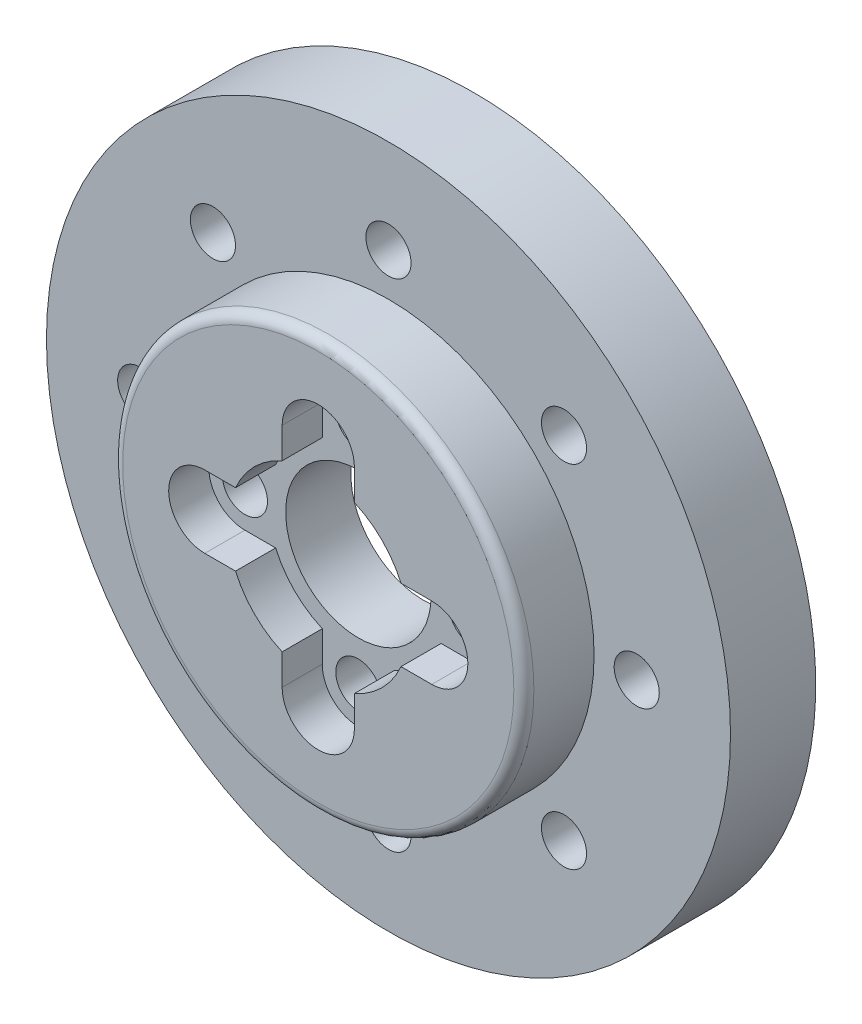
from build123d import *
from build123d.topology import SkipClean

# Parameters (mm, degrees)
SKETCH1_R               = 34.1
BOSS_EXTRUDE1_DEPTH     = 1.75
SKETCH4_R               = 28.5
BOSS_EXTRUDE2_DEPTH     = 2
SKETCH5_R               = 34.1
SKETCH5_R_2             = 16.25
BOSS_EXTRUDE3_DEPTH     = 5
CUT_EXTRUDE2_DEPTH      = 49.968050809
CUT_EXTRUDE2_DEPTH_BACK = 49.968050809
SKETCH3_R               = 2.25
CUT_EXTRUDE1_DEPTH      = 49.968050809
CUT_EXTRUDE1_DEPTH_BACK = 49.968050809
SKETCH2_R               = 7.25
SKETCH6_R               = 2.25
CUT_EXTRUDE3_DEPTH      = 50.354533733
CIRPATTERN1_COUNT       = 8
SKETCH7_R               = 20.5
SKETCH7_R_2             = 2.25
SKETCH7_R_3             = 7.25
BOSS_EXTRUDE4_DEPTH     = 5
BOSS_EXTRUDE5_START     = 2
SKETCH8_R               = 34.1
SKETCH8_R_2             = 28.5
BOSS_EXTRUDE5_DEPTH     = 2
SKETCH10_R              = 34.1
SKETCH10_R_2            = 20.5
CUT_EXTRUDE4_DEPTH      = 2
CUT_EXTRUDE5_DEPTH      = 4
SKETCH12_R              = 4.6
CUT_EXTRUDE6_DEPTH      = 3
FILLET2_R               = 1
FILLET3_R               = 1


with BuildPart() as part:
    # Sketch1 → Boss-Extrude1 (new, symmetric)
    with BuildSketch(Plane.XY):
        Circle(SKETCH1_R)
    extrude(amount=BOSS_EXTRUDE1_DEPTH, both=True)

    # Sketch4 → Boss-Extrude2 (add)
    with BuildSketch(Plane.XY.offset(1.75)):
        Circle(SKETCH4_R)
    extrude(amount=BOSS_EXTRUDE2_DEPTH)

    # Sketch5 → Boss-Extrude3 (add)
    with BuildSketch(Plane(origin=(0, 0, -1.75), x_dir=(-1, 0, 0), z_dir=(0, 0, -1))):
        Circle(SKETCH5_R)
        Circle(SKETCH5_R_2, mode=Mode.SUBTRACT)
    extrude(amount=BOSS_EXTRUDE3_DEPTH)

    # Sketch3 → Cut-Extrude2 (cut, two sides: drawn at the far end of the back side and taken through both)
    with BuildSketch(Plane.XY.offset(1.75).offset(-CUT_EXTRUDE2_DEPTH_BACK)):
        with Locations((0, 11.3137085)):
            Circle(SKETCH3_R)
        with Locations((11.3137085, 0)):
            Circle(SKETCH3_R)
        with Locations((0, -11.3137085)):
            Circle(SKETCH3_R)
        with Locations((-11.3137085, 0)):
            Circle(SKETCH3_R)
    extrude(amount=CUT_EXTRUDE2_DEPTH + CUT_EXTRUDE2_DEPTH_BACK, mode=Mode.SUBTRACT)

    # Sketch2 → Cut-Extrude1 (cut, two sides: drawn at the far end of the back side and taken through both)
    with BuildSketch(Plane.XY.offset(1.75).offset(-CUT_EXTRUDE1_DEPTH_BACK)):
        Circle(SKETCH2_R)
    extrude(amount=CUT_EXTRUDE1_DEPTH + CUT_EXTRUDE1_DEPTH_BACK, mode=Mode.SUBTRACT)

    # Sketch6 → Cut-Extrude3 (cut, symmetric)
    with BuildSketch(Plane.XY.offset(3.75)):
        with Locations((0, 24.75)):
            Circle(SKETCH6_R)
    cut_extrude3 = extrude(amount=CUT_EXTRUDE3_DEPTH, both=True, mode=Mode.SUBTRACT)

    # CirPattern1: Cut-Extrude3 ×8 about axis
    cirpattern1_axis = Axis((0, 0, 0), (0, 0, 1))
    for i in range(1, CIRPATTERN1_COUNT):
        add(cut_extrude3.rotate(cirpattern1_axis, i * 360 / CIRPATTERN1_COUNT), mode=Mode.SUBTRACT)

    # Sketch7 → Boss-Extrude4 (add)
    with BuildSketch(Plane.XY.offset(3.75)):
        Circle(SKETCH7_R)
        with Locations((0, -11.3137085)):
            Circle(SKETCH7_R_2, mode=Mode.SUBTRACT)
        with Locations((11.3137085, 0)):
            Circle(SKETCH7_R_2, mode=Mode.SUBTRACT)
        with Locations((0, 11.3137085)):
            Circle(SKETCH7_R_2, mode=Mode.SUBTRACT)
        with Locations((-11.3137085, 0)):
            Circle(SKETCH7_R_2, mode=Mode.SUBTRACT)
        Circle(SKETCH7_R_3, mode=Mode.SUBTRACT)
    extrude(amount=BOSS_EXTRUDE4_DEPTH)

    # Sketch8 → Boss-Extrude5 (add)
    with SkipClean():  # the faces are left unmerged after this step: merging them gives an invalid solid
        with BuildSketch(Plane.XY.offset(1.75).offset(BOSS_EXTRUDE5_START)):
            with Locations(Location((0, 0, 0), (0, 0, 180))):
                Circle(SKETCH8_R)
            Circle(SKETCH8_R_2, mode=Mode.SUBTRACT)
        extrude(amount=-BOSS_EXTRUDE5_DEPTH)

    # Sketch10 → Cut-Extrude4 (cut)
    with BuildSketch(Plane.XY.offset(3.75)):
        with Locations(Location((0, 0, 0), (0, 0, 180))):
            Circle(SKETCH10_R)
        Circle(SKETCH10_R_2, mode=Mode.SUBTRACT)
    extrude(amount=-CUT_EXTRUDE4_DEPTH, mode=Mode.SUBTRACT)

    # Sketch11 → Cut-Extrude5 (cut)
    with BuildSketch(Plane.XY.offset(8.75)):
        with BuildLine():
            Line((-11.3137085, 3.6), (-8.248636251, 3.6))
            ThreePointArc((-8.248636251, 3.6), (-6.363961031, 6.363961031), (-3.6, 8.248636251))
            Line((-3.6, 8.248636251), (-3.6, 11.3137085))
            ThreePointArc((-3.6, 11.3137085), (0, 14.9137085), (3.6, 11.3137085))
            Line((3.6, 11.3137085), (3.6, 8.248636251))
            ThreePointArc((3.6, 8.248636251), (6.363961031, 6.363961031), (8.248636251, 3.6))
            Line((8.248636251, 3.6), (11.3137085, 3.6))
            ThreePointArc((11.3137085, 3.6), (14.9137085, 0), (11.3137085, -3.6))
            Line((11.3137085, -3.6), (8.248636251, -3.6))
            ThreePointArc((8.248636251, -3.6), (6.363961031, -6.363961031), (3.6, -8.248636251))
            Line((3.6, -8.248636251), (3.6, -11.3137085))
            ThreePointArc((3.6, -11.3137085), (0, -14.9137085), (-3.6, -11.3137085))
            Line((-3.6, -11.3137085), (-3.6, -8.248636251))
            ThreePointArc((-3.6, -8.248636251), (-6.363961031, -6.363961031), (-8.248636251, -3.6))
            Line((-8.248636251, -3.6), (-11.3137085, -3.6))
            ThreePointArc((-11.3137085, -3.6), (-14.9137085, 0), (-11.3137085, 3.6))
        make_face()
    extrude(amount=-CUT_EXTRUDE5_DEPTH, mode=Mode.SUBTRACT)

    # Sketch12 → Cut-Extrude6 (cut)
    with BuildSketch(Plane(origin=(0, 0, -6.75), x_dir=(-1, 0, 0), z_dir=(0, 0, -1))):
        with Locations((0, 24.75)):
            Circle(SKETCH12_R)
        with Locations((17.500892834, 17.500892834)):
            Circle(SKETCH12_R)
        with Locations((24.75, 0)):
            Circle(SKETCH12_R)
        with Locations((17.500892834, -17.500892834)):
            Circle(SKETCH12_R)
        with Locations((0, -24.75)):
            Circle(SKETCH12_R)
        with Locations((-17.500892834, -17.500892834)):
            Circle(SKETCH12_R)
        with Locations((-24.75, 0)):
            Circle(SKETCH12_R)
        with Locations((-17.500892834, 17.500892834)):
            Circle(SKETCH12_R)
    extrude(amount=-CUT_EXTRUDE6_DEPTH, mode=Mode.SUBTRACT)

    # Fillet2
    fillet2_edges = [part.edges().sort_by_distance(p)[0] for p in [
        (-20.5, 0, 8.75),
    ]]
    fillet(fillet2_edges, radius=FILLET2_R)

    # Fillet3
    fillet3_edges = [part.edges().sort_by_distance(p)[0] for p in [
        (16.25, 0, -1.75),
    ]]
    fillet(fillet3_edges, radius=FILLET3_R)


solid = part.part
